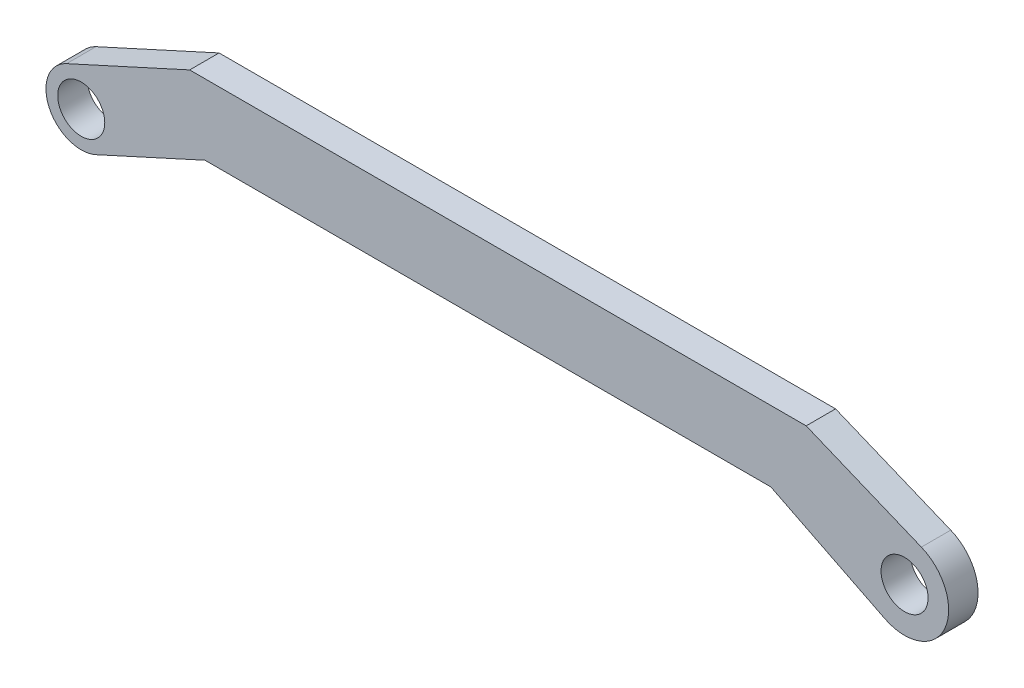
from build123d import *

# Parameters (mm, degrees)
SCHIZZO1_R                   = 4
ESTRUSIONE_ESTRUSIONE1_DEPTH = 5


with BuildPart() as part:
    # Schizzo1 → Estrusione-Estrusione1 (new body)
    with BuildSketch(Plane.XY):
        with BuildLine():
            Line((18.440051647, 15), (123.269745712, 15))
            Line((123.269745712, 15), (142.855666239, 6.935068156))
            ThreePointArc((142.855666239, 6.935068156), (146.82520143, -3.10911972), (136.641644665, -6.706075562))
            Line((136.641644665, -6.706075562), (117.260230363, 3))
            Line((117.260230363, 3), (21.046177465, 3))
            Line((21.046177465, 3), (2.488742023, -5.459502096))
            ThreePointArc((2.488742023, -5.459502096), (-5.459502096, -2.488742023), (-2.488742023, 5.459502096))
            Line((-2.488742023, 5.459502096), (18.440051647, 15))
        make_face()
        Circle(SCHIZZO1_R, mode=Mode.SUBTRACT)
        with Locations((140, 0)):
            Circle(SCHIZZO1_R, mode=Mode.SUBTRACT)
    extrude(amount=ESTRUSIONE_ESTRUSIONE1_DEPTH)


solid = part.part
